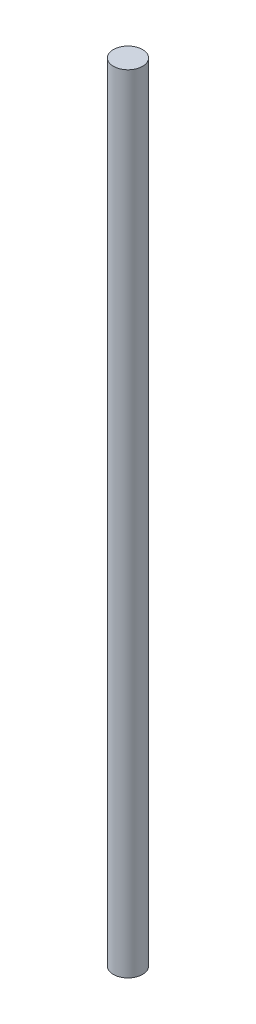
from build123d import *

# Parameters (mm, degrees)
SKETCH1_R           = 1
BOSS_EXTRUDE1_DEPTH = 54


with BuildPart() as part:
    # Sketch1 → Boss-Extrude1 (new body)
    with BuildSketch(Plane(origin=(0, 0, 0), x_dir=(1, 0, 0), z_dir=(0, 1, 0))):
        with Locations(Location((0, 0, 0), (0, 0, 270))):
            Circle(SKETCH1_R)
    extrude(amount=BOSS_EXTRUDE1_DEPTH)


solid = part.part
